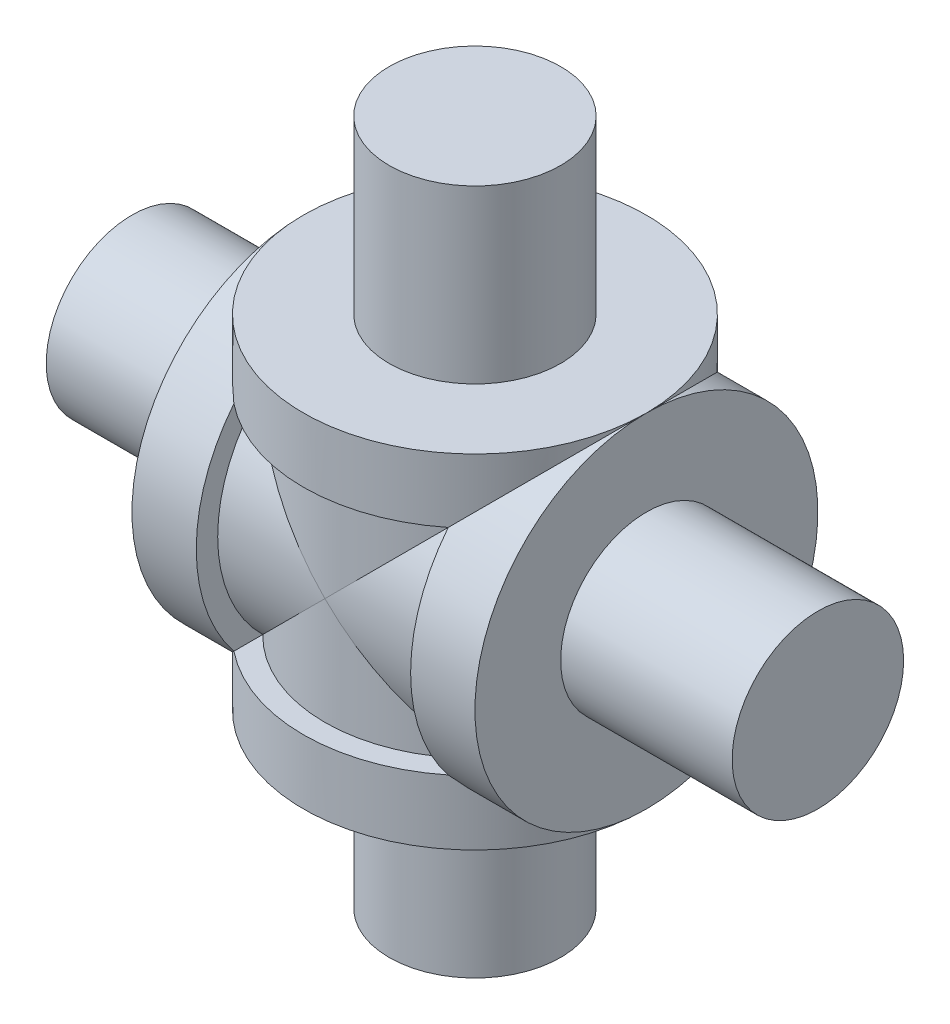
from build123d import *


with BuildPart() as part:
    # Sketch1 → Revolve1 (revolve)
    with BuildSketch(Plane.XY):
        Polygon((-80, 20), (-80, 0), (80, 0), (80, 20), (40, 20), (40, 40), (25, 40), (25, 35), (-25, 35), (-25, 40), (-40, 40), (-40, 20), align=None)
    revolve(axis=Axis((0, 0, 0), (-1, 0, 0)))

    # Sketch1<4> → Revolve3 (revolve)
    with BuildSketch(Plane.XY):
        Polygon((0, -80), (20, -80), (20, -40), (40, -40), (40, -25), (35, -25), (35, 25), (40, 25), (40, 40), (20, 40), (20, 80), (0, 80), align=None)
    revolve(axis=Axis((0, 80, 0), (0, -1, 0)))


solid = part.part
